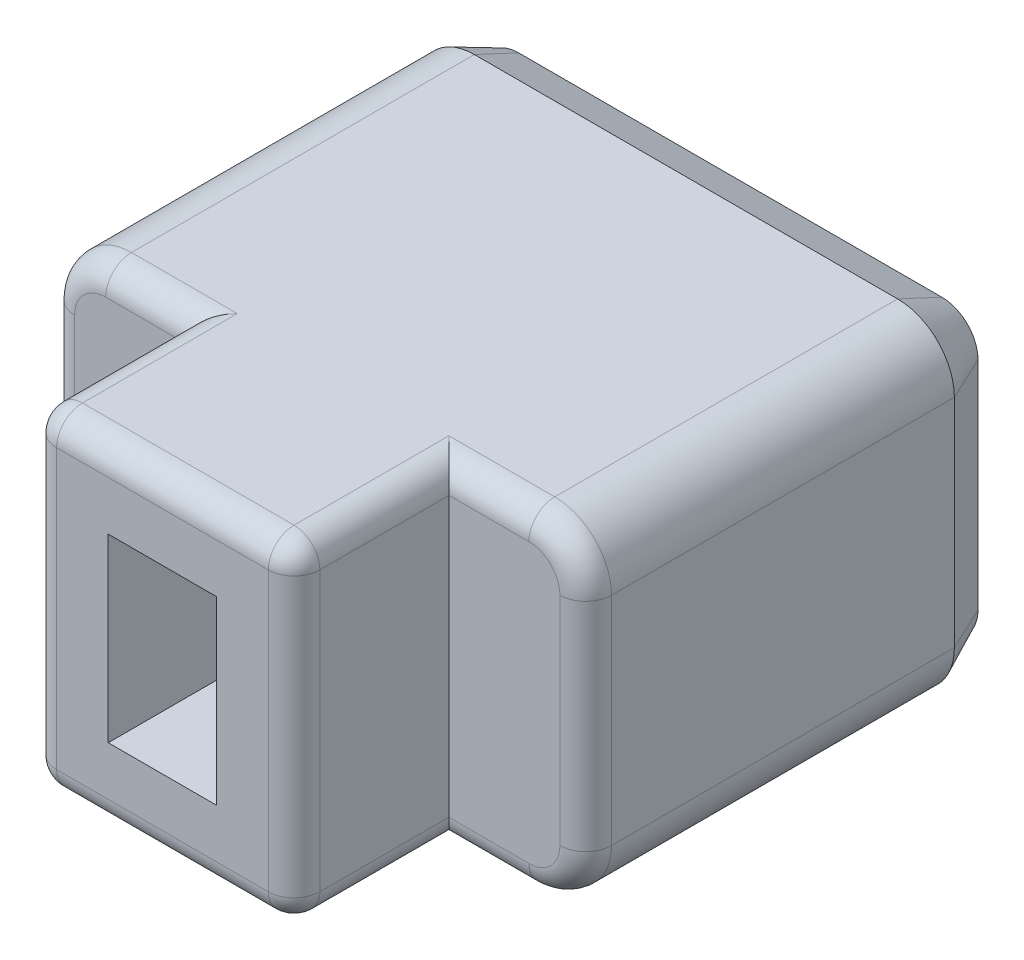
from build123d import *

# Parameters (mm, degrees)
BOSS_EXTRU_1_DEPTH      = 11
ESQUISSE3_W             = 2.1
ESQUISSE3_H             = 3.5
ENL_V_MAT_EXTRU_1_DEPTH = 3
ESQUISSE4_OUTSIDE_W     = 15.688
ESQUISSE4_OUTSIDE_H     = 11.688
ESQUISSE4_OUTSIDE_W_2   = 5.1
ESQUISSE4_OUTSIDE_H_2   = 6.4
ENL_V_MAT_EXTRU_2_DEPTH = 3
CONG_1_R                = 0.5
CHANFREIN1_SIZE         = 0.4
CHANFREIN1_SIZE2        = 0.857802768
ENL_V_MAT_EXTRU_3_DEPTH = 0.3
BOSS_EXTRU_2_DEPTH      = 0.3


with BuildPart() as part:
    # Esquisse2 → Boss.-Extru.1 (new body)
    with BuildSketch(Plane.XY):
        with BuildLine():
            Line((1.1, 0), (9.3, 0))
            ThreePointArc((9.3, 0), (10.077817459, 0.322182541), (10.4, 1.1))
            Line((10.4, 1.1), (10.4, 5.3))
            ThreePointArc((10.4, 5.3), (10.077817459, 6.077817459), (9.3, 6.4))
            Line((9.3, 6.4), (1.1, 6.4))
            ThreePointArc((1.1, 6.4), (0.322182541, 6.077817459), (0, 5.3))
            Line((0, 5.3), (0, 1.1))
            ThreePointArc((0, 1.1), (0.322182541, 0.322182541), (1.1, 0))
        make_face()
    extrude(amount=BOSS_EXTRU_1_DEPTH)

    # Esquisse3 → Enlèv. mat.-Extru.1 (cut)
    with BuildSketch(Plane.XY.offset(11)):
        with Locations((5.2, 3.2)):
            Rectangle(ESQUISSE3_W, ESQUISSE3_H)
    extrude(amount=-ENL_V_MAT_EXTRU_1_DEPTH, mode=Mode.SUBTRACT)

    # Esquisse4 outside → Enlèv. mat.-Extru.2 (cut)
    with BuildSketch(Plane.XY.offset(11)):
        with Locations((5.2, 3.2)):
            Rectangle(ESQUISSE4_OUTSIDE_W, ESQUISSE4_OUTSIDE_H)
        with Locations((5.2, 3.2)):
            Rectangle(ESQUISSE4_OUTSIDE_W_2, ESQUISSE4_OUTSIDE_H_2, mode=Mode.SUBTRACT)
    extrude(amount=-ENL_V_MAT_EXTRU_2_DEPTH, mode=Mode.SUBTRACT)

    # Congé1
    cong_1_edges = [part.edges().sort_by_distance(p)[0] for p in [
        (8.525, 0, 8),
        (10.077817459, 0.322182541, 8),
        (10.4, 3.2, 8),
        (10.077817459, 6.077817459, 8),
        (1.875, 6.4, 8),
        (0.322182541, 6.077817459, 8),
        (1.875, 0, 8),
        (0.322182541, 0.322182541, 8),
        (7.75, 6.4, 9.5),
        (2.65, 6.4, 9.5),
        (7.75, 0, 9.5),
        (2.65, 0, 9.5),
        (2.65, 3.2, 11),
        (5.2, 6.4, 11),
        (7.75, 3.2, 11),
        (5.2, 0, 11),
        (8.525, 6.4, 8),
        (0, 3.2, 8),
    ]]
    fillet(cong_1_edges, radius=CONG_1_R)

    # Chanfrein1
    chanfrein1_edges = [part.edges().sort_by_distance(p)[0] for p in [
        (5.2, 0, 0),
        (10.077817459, 0.322182541, 0),
        (0.322182541, 0.322182541, 0),
        (10.4, 3.2, 0),
        (0, 3.2, 0),
        (10.077817459, 6.077817459, 0),
        (0.322182541, 6.077817459, 0),
        (5.2, 6.4, 0),
    ]]
    chanfrein1_side = [part.faces().sort_by_distance(p)[0] for p in [
        (5.2, 3.2, 0),
    ]]
    chamfer(chanfrein1_edges, length=CHANFREIN1_SIZE, length2=CHANFREIN1_SIZE2, reference=chanfrein1_side[0])

    # Esquisse5 → Enlèv. mat.-Extru.3 (cut)
    with BuildSketch(Plane(origin=(0, 0, 0), x_dir=(-1, 0, 0), z_dir=(0, 0, -1))):
        with BuildLine():
            Line((-4.482051282, 2.530769231), (-4.123076923, 2.530769231))
            add(Edge.make_bspline(
                [(-4.123076923, 2.530769231), (-4.125288791, 2.483167835), (-4.129628304, 2.38977759), (-4.148345226, 2.253406764), (-4.17627157, 2.123340974), (-4.214430497, 1.999774332), (-4.264003017, 1.882875843), (-4.322214341, 1.772104955), (-4.390812153, 1.667880652), (-4.469114009, 1.571707448), (-4.554057931, 1.483919975), (-4.644999905, 1.40685226), (-4.741707449, 1.342960833), (-4.842452966, 1.288958809), (-4.948745531, 1.248523316), (-5.059476378, 1.218360764), (-5.175371631, 1.20039124), (-5.254424579, 1.198430934), (-5.294551282, 1.197435897)],
                knots=[0, 0, 0, 0, 1.157348951, 2.270628868, 3.339854951, 4.38667075, 5.407537659, 6.420681518, 7.423232439, 8.433712426, 9.429582902, 10.387626108, 11.323566714, 12.240895944, 13.159234641, 14.08016076, 15.025503541, 16, 16, 16, 16], degree=3))
            add(Edge.make_bspline(
                [(-5.294551282, 1.197435897), (-5.334145732, 1.198452907), (-5.411571118, 1.200441629), (-5.524656609, 1.21779834), (-5.631972566, 1.245644285), (-5.733347647, 1.285405213), (-5.829860921, 1.335017556), (-5.919496382, 1.397590144), (-6.004703762, 1.46975275), (-6.081123559, 1.5541066), (-6.151305619, 1.644524098), (-6.212479674, 1.740269139), (-6.264074813, 1.84001067), (-6.305766774, 1.943971528), (-6.338623907, 2.051748411), (-6.363073845, 2.163391861), (-6.376536348, 2.27936847), (-6.378494424, 2.357926884), (-6.379487179, 2.39775641)],
                knots=[0, 0, 0, 0, 1.051711384, 2.056580109, 3.032785785, 3.992411975, 4.944870775, 5.909628692, 6.891264423, 7.905937952, 8.928180638, 9.930438659, 10.920939654, 11.90820525, 12.902894, 13.912265297, 14.941507625, 16, 16, 16, 16], degree=3))
            add(Edge.make_bspline(
                [(-6.379487179, 2.39775641), (-6.377839472, 2.453953141), (-6.374580282, 2.565111134), (-6.347168361, 2.728800384), (-6.303149453, 2.886887627), (-6.250722421, 3.014802725), (-6.198201191, 3.118349126), (-6.149988377, 3.20289044), (-6.093728221, 3.294189286), (-6.029601708, 3.39217379), (-5.956201308, 3.496129892), (-5.875464864, 3.607400157), (-5.786519112, 3.725431188), (-5.723152213, 3.805216599), (-5.690384615, 3.846474359)],
                knots=[0, 0, 0, 0, 1.233535321, 2.439951703, 3.634083941, 4.831223584, 5.468697265, 6.183186553, 6.967907589, 7.823691141, 8.75452848, 9.762411661, 10.842922778, 12, 12, 12, 12], degree=3))
            Line((-5.690384615, 3.846474359), (-4.842628205, 4.88974359))
            Line((-4.842628205, 4.88974359), (-6.430769231, 4.88974359))
            Line((-6.430769231, 4.88974359), (-6.430769231, 5.3))
            Line((-6.430769231, 5.3), (-4.020512821, 5.3))
            Line((-4.020512821, 5.3), (-5.365064103, 3.644551282))
            add(Edge.make_bspline(
                [(-5.365064103, 3.644551282), (-5.397745675, 3.605100528), (-5.460603999, 3.529222652), (-5.549603262, 3.418669742), (-5.629661676, 3.316044094), (-5.701640907, 3.221866579), (-5.762597652, 3.13412526), (-5.817275763, 3.056046675), (-5.861156189, 2.984603177), (-5.908327651, 2.90098471), (-5.953668714, 2.799212438), (-5.992546748, 2.675350358), (-6.015606974, 2.547916595), (-6.018867975, 2.461950804), (-6.020512821, 2.418589744)],
                knots=[0, 0, 0, 0, 1.297618079, 2.495782571, 3.594697613, 4.594628131, 5.497499245, 6.300647139, 7.008465005, 7.620238698, 8.731681699, 9.822989966, 10.90191829, 12, 12, 12, 12], degree=3))
            add(Edge.make_bspline(
                [(-6.020512821, 2.418589744), (-6.019990945, 2.391309583), (-6.018963655, 2.337609776), (-6.00804603, 2.258798363), (-5.991206453, 2.182940499), (-5.968024047, 2.109551218), (-5.93760043, 2.039268902), (-5.900315416, 1.971886744), (-5.855851328, 1.907866735), (-5.806135812, 1.84666214), (-5.751096427, 1.790909038), (-5.692685985, 1.741537482), (-5.630525782, 1.700728345), (-5.565785281, 1.666414234), (-5.497765049, 1.639975215), (-5.426714126, 1.621736358), (-5.352897954, 1.609999916), (-5.30260961, 1.608472493), (-5.276923077, 1.607692308)],
                knots=[0, 0, 0, 0, 1.06989504, 2.106041779, 3.115552866, 4.11659498, 5.121251965, 6.115853611, 7.133385419, 8.176137438, 9.206329872, 10.203413544, 11.171427972, 12.118447235, 13.074126855, 14.027447124, 14.992449553, 16, 16, 16, 16], degree=3))
            add(Edge.make_bspline(
                [(-5.276923077, 1.607692308), (-5.250168937, 1.608481971), (-5.19749153, 1.610036773), (-5.120245041, 1.62174089), (-5.045722505, 1.639561172), (-4.975560355, 1.667546757), (-4.90808558, 1.700823022), (-4.845406646, 1.743589853), (-4.784895696, 1.79215878), (-4.728916056, 1.849323749), (-4.677902675, 1.913376499), (-4.631812933, 1.98354724), (-4.591996629, 2.059930043), (-4.557203996, 2.142033118), (-4.529156456, 2.23058454), (-4.508316805, 2.325391202), (-4.490631794, 2.425822556), (-4.48496141, 2.495175992), (-4.482051282, 2.530769231)],
                knots=[0, 0, 0, 0, 0.947461108, 1.865498056, 2.762867956, 3.655585777, 4.535828722, 5.422911659, 6.337724158, 7.281207503, 8.250670221, 9.234891363, 10.250764949, 11.298232114, 12.39055947, 13.53602619, 14.735451151, 16, 16, 16, 16], degree=3))
        make_face()
    extrude(amount=-ENL_V_MAT_EXTRU_3_DEPTH, mode=Mode.SUBTRACT)


with BuildPart() as body_2:
    # Esquisse5<2> → Boss.-Extru.2 (new body)
    with BuildSketch(Plane(origin=(0, 0, 0), x_dir=(-1, 0, 0), z_dir=(0, 0, -1))):
        with BuildLine():
            Line((-4.482051282, 2.530769231), (-4.123076923, 2.530769231))
            add(Edge.make_bspline(
                [(-4.123076923, 2.530769231), (-4.125288791, 2.483167835), (-4.129628304, 2.38977759), (-4.148345226, 2.253406764), (-4.17627157, 2.123340974), (-4.214430497, 1.999774332), (-4.264003017, 1.882875843), (-4.322214341, 1.772104955), (-4.390812153, 1.667880652), (-4.469114009, 1.571707448), (-4.554057931, 1.483919975), (-4.644999905, 1.40685226), (-4.741707449, 1.342960833), (-4.842452966, 1.288958809), (-4.948745531, 1.248523316), (-5.059476378, 1.218360764), (-5.175371631, 1.20039124), (-5.254424579, 1.198430934), (-5.294551282, 1.197435897)],
                knots=[0, 0, 0, 0, 1.157348951, 2.270628868, 3.339854951, 4.38667075, 5.407537659, 6.420681518, 7.423232439, 8.433712426, 9.429582902, 10.387626108, 11.323566714, 12.240895944, 13.159234641, 14.08016076, 15.025503541, 16, 16, 16, 16], degree=3))
            add(Edge.make_bspline(
                [(-5.294551282, 1.197435897), (-5.334145732, 1.198452907), (-5.411571118, 1.200441629), (-5.524656609, 1.21779834), (-5.631972566, 1.245644285), (-5.733347647, 1.285405213), (-5.829860921, 1.335017556), (-5.919496382, 1.397590144), (-6.004703762, 1.46975275), (-6.081123559, 1.5541066), (-6.151305619, 1.644524098), (-6.212479674, 1.740269139), (-6.264074813, 1.84001067), (-6.305766774, 1.943971528), (-6.338623907, 2.051748411), (-6.363073845, 2.163391861), (-6.376536348, 2.27936847), (-6.378494424, 2.357926884), (-6.379487179, 2.39775641)],
                knots=[0, 0, 0, 0, 1.051711384, 2.056580109, 3.032785785, 3.992411975, 4.944870775, 5.909628692, 6.891264423, 7.905937952, 8.928180638, 9.930438659, 10.920939654, 11.90820525, 12.902894, 13.912265297, 14.941507625, 16, 16, 16, 16], degree=3))
            add(Edge.make_bspline(
                [(-6.379487179, 2.39775641), (-6.377839472, 2.453953141), (-6.374580282, 2.565111134), (-6.347168361, 2.728800384), (-6.303149453, 2.886887627), (-6.250722421, 3.014802725), (-6.198201191, 3.118349126), (-6.149988377, 3.20289044), (-6.093728221, 3.294189286), (-6.029601708, 3.39217379), (-5.956201308, 3.496129892), (-5.875464864, 3.607400157), (-5.786519112, 3.725431188), (-5.723152213, 3.805216599), (-5.690384615, 3.846474359)],
                knots=[0, 0, 0, 0, 1.233535321, 2.439951703, 3.634083941, 4.831223584, 5.468697265, 6.183186553, 6.967907589, 7.823691141, 8.75452848, 9.762411661, 10.842922778, 12, 12, 12, 12], degree=3))
            Line((-5.690384615, 3.846474359), (-4.842628205, 4.88974359))
            Line((-4.842628205, 4.88974359), (-6.430769231, 4.88974359))
            Line((-6.430769231, 4.88974359), (-6.430769231, 5.3))
            Line((-6.430769231, 5.3), (-4.020512821, 5.3))
            Line((-4.020512821, 5.3), (-5.365064103, 3.644551282))
            add(Edge.make_bspline(
                [(-5.365064103, 3.644551282), (-5.397745675, 3.605100528), (-5.460603999, 3.529222652), (-5.549603262, 3.418669742), (-5.629661676, 3.316044094), (-5.701640907, 3.221866579), (-5.762597652, 3.13412526), (-5.817275763, 3.056046675), (-5.861156189, 2.984603177), (-5.908327651, 2.90098471), (-5.953668714, 2.799212438), (-5.992546748, 2.675350358), (-6.015606974, 2.547916595), (-6.018867975, 2.461950804), (-6.020512821, 2.418589744)],
                knots=[0, 0, 0, 0, 1.297618079, 2.495782571, 3.594697613, 4.594628131, 5.497499245, 6.300647139, 7.008465005, 7.620238698, 8.731681699, 9.822989966, 10.90191829, 12, 12, 12, 12], degree=3))
            add(Edge.make_bspline(
                [(-6.020512821, 2.418589744), (-6.019990945, 2.391309583), (-6.018963655, 2.337609776), (-6.00804603, 2.258798363), (-5.991206453, 2.182940499), (-5.968024047, 2.109551218), (-5.93760043, 2.039268902), (-5.900315416, 1.971886744), (-5.855851328, 1.907866735), (-5.806135812, 1.84666214), (-5.751096427, 1.790909038), (-5.692685985, 1.741537482), (-5.630525782, 1.700728345), (-5.565785281, 1.666414234), (-5.497765049, 1.639975215), (-5.426714126, 1.621736358), (-5.352897954, 1.609999916), (-5.30260961, 1.608472493), (-5.276923077, 1.607692308)],
                knots=[0, 0, 0, 0, 1.06989504, 2.106041779, 3.115552866, 4.11659498, 5.121251965, 6.115853611, 7.133385419, 8.176137438, 9.206329872, 10.203413544, 11.171427972, 12.118447235, 13.074126855, 14.027447124, 14.992449553, 16, 16, 16, 16], degree=3))
            add(Edge.make_bspline(
                [(-5.276923077, 1.607692308), (-5.250168937, 1.608481971), (-5.19749153, 1.610036773), (-5.120245041, 1.62174089), (-5.045722505, 1.639561172), (-4.975560355, 1.667546757), (-4.90808558, 1.700823022), (-4.845406646, 1.743589853), (-4.784895696, 1.79215878), (-4.728916056, 1.849323749), (-4.677902675, 1.913376499), (-4.631812933, 1.98354724), (-4.591996629, 2.059930043), (-4.557203996, 2.142033118), (-4.529156456, 2.23058454), (-4.508316805, 2.325391202), (-4.490631794, 2.425822556), (-4.48496141, 2.495175992), (-4.482051282, 2.530769231)],
                knots=[0, 0, 0, 0, 0.947461108, 1.865498056, 2.762867956, 3.655585777, 4.535828722, 5.422911659, 6.337724158, 7.281207503, 8.250670221, 9.234891363, 10.250764949, 11.298232114, 12.39055947, 13.53602619, 14.735451151, 16, 16, 16, 16], degree=3))
        make_face()
    extrude(amount=BOSS_EXTRU_2_DEPTH)


solid = Compound([part.part, body_2.part])
